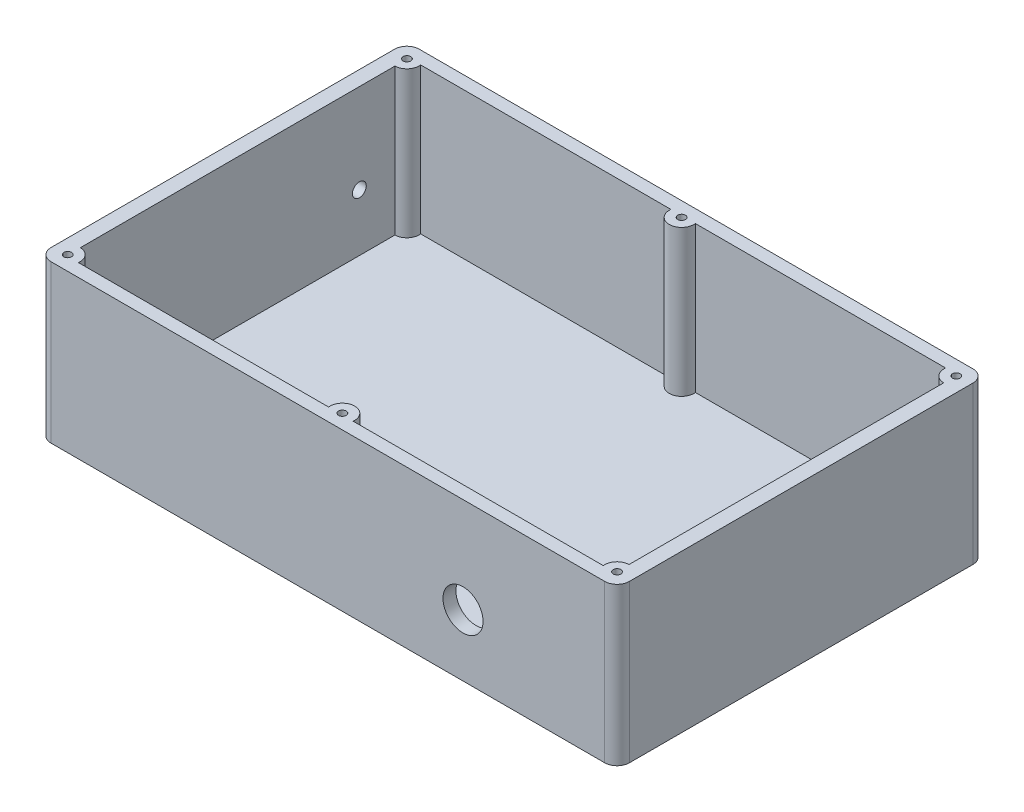
from build123d import *

# Parameters (mm, degrees)
BOSS_EXTRUDE1_DEPTH            = 51
CUT_EXTRUDE1_DEPTH             = 47.5
M3X0_5_TAPPED_HOLE1_D          = 2.5
M3X0_5_TAPPED_HOLE1_DEPTH      = 7.5
M3X0_5_TAPPED_HOLE1_TIP        = 0.751075774
M4_CLEARANCE_HOLE2_D           = 4.5
M4_CLEARANCE_HOLE2_DEPTH       = 4.8
F_13_0_13_DIAMETER_HOLE1_D     = 13
F_13_0_13_DIAMETER_HOLE1_DEPTH = 4.2


with BuildPart() as part:
    # Sketch1 → Boss-Extrude1 (new body)
    with BuildSketch(Plane(origin=(0, 0, 0), x_dir=(1, 0, 0), z_dir=(0, 1, 0))):
        with BuildLine():
            Line((-89.85, 59.75), (89.85, 59.75))
            ThreePointArc((89.85, 59.75), (92.678427125, 58.578427125), (93.85, 55.75))
            Line((93.85, 55.75), (93.85, -55.75))
            ThreePointArc((93.85, -55.75), (92.678427125, -58.578427125), (89.85, -59.75))
            Line((89.85, -59.75), (-89.85, -59.75))
            ThreePointArc((-89.85, -59.75), (-92.678427125, -58.578427125), (-93.85, -55.75))
            Line((-93.85, -55.75), (-93.85, 55.75))
            ThreePointArc((-93.85, 55.75), (-92.678427125, 58.578427125), (-89.85, 59.75))
        make_face()
    extrude(amount=BOSS_EXTRUDE1_DEPTH)

    # Sketch2 → Cut-Extrude1 (cut)
    with BuildSketch(Plane(origin=(0, 51, 0), x_dir=(1, 0, 0), z_dir=(0, 1, 0))):
        with BuildLine():
            Line((-89.05, 51.051250195), (-89.05, -51.051250195))
            ThreePointArc((-89.05, -51.051250195), (-86.117159945, -52.441958359), (-85.181373033, -55.55))
            Line((-85.181373033, -55.55), (-3.968626967, -55.55))
            ThreePointArc((-3.968626967, -55.55), (0, -51.05), (3.968626967, -55.55))
            Line((3.968626967, -55.55), (85.181373033, -55.55))
            ThreePointArc((85.181373033, -55.55), (86.117159945, -52.441958359), (89.05, -51.051250195))
            Line((89.05, -51.051250195), (89.05, 51.051250195))
            ThreePointArc((89.05, 51.051250195), (86.117159945, 52.441958359), (85.181373033, 55.55))
            Line((85.181373033, 55.55), (3.968626967, 55.55))
            ThreePointArc((3.968626967, 55.55), (0, 51.05), (-3.968626967, 55.55))
            Line((-3.968626967, 55.55), (-85.181373033, 55.55))
            ThreePointArc((-85.181373033, 55.55), (-86.117159945, 52.441958359), (-89.05, 51.051250195))
        make_face()
    extrude(amount=-CUT_EXTRUDE1_DEPTH, mode=Mode.SUBTRACT)

    # M3x0.5 Tapped Hole1
    with Locations(Plane(origin=(0, 51, 0), x_dir=(1, 0, 0), z_dir=(0, 1, 0))):
        with Locations((-89.15, 55.05), (-89.15, -55.05), (89.15, -55.05), (89.15, 55.05), (0, -55.05), (0, 55.05)):
            Hole(M3X0_5_TAPPED_HOLE1_D / 2, depth=M3X0_5_TAPPED_HOLE1_DEPTH)
            with Locations((0, 0, -(M3X0_5_TAPPED_HOLE1_DEPTH + M3X0_5_TAPPED_HOLE1_TIP / 2))):  # 118° drill point
                Cone(0, M3X0_5_TAPPED_HOLE1_D / 2, M3X0_5_TAPPED_HOLE1_TIP, mode=Mode.SUBTRACT)

    # M4 Clearance Hole2
    with Locations(Plane.ZY.offset(93.85)):
        with Locations((-39.5, 22), (39.5, 22)):
            Hole(M4_CLEARANCE_HOLE2_D / 2, depth=M4_CLEARANCE_HOLE2_DEPTH)

    # Ø13.0 (13) Diameter Hole1
    with Locations(Plane.XY.offset(59.75)):
        with Locations((43.85, 20)):
            Hole(F_13_0_13_DIAMETER_HOLE1_D / 2, depth=F_13_0_13_DIAMETER_HOLE1_DEPTH)


solid = part.part
